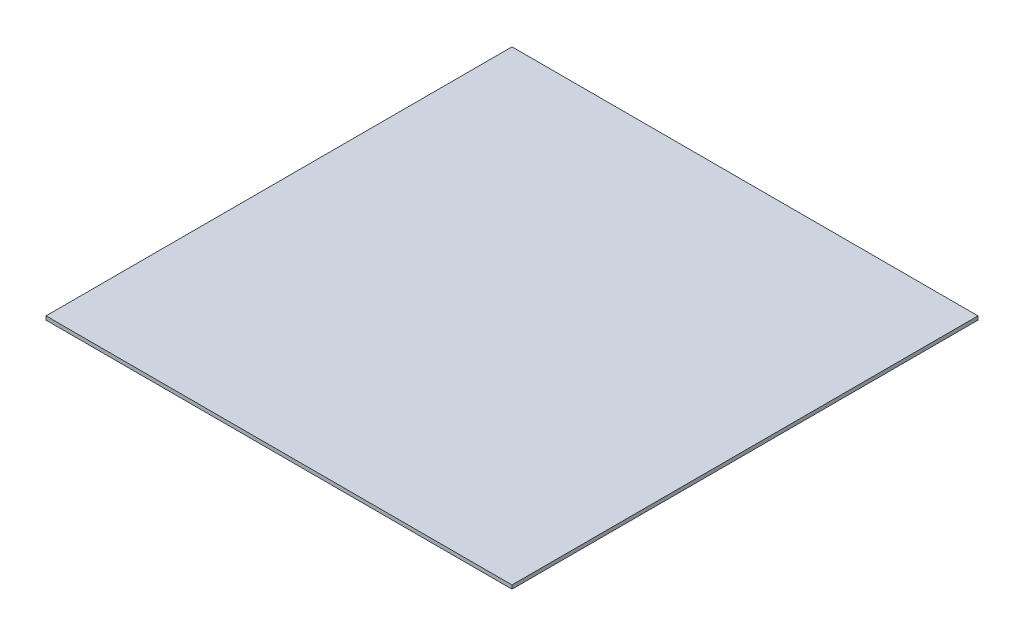
from build123d import *

# Parameters (mm, degrees)
SKETCH1_W           = 400
SKETCH1_H           = 400
BOSS_EXTRUDE1_DEPTH = 3.175


with BuildPart() as part:
    # Sketch1 → Boss-Extrude1 (new body)
    with BuildSketch(Plane(origin=(0, 0, 0), x_dir=(1, 0, 0), z_dir=(0, 1, 0))):
        with Locations((200, 200)):
            Rectangle(SKETCH1_W, SKETCH1_H)
    extrude(amount=BOSS_EXTRUDE1_DEPTH)


solid = part.part
